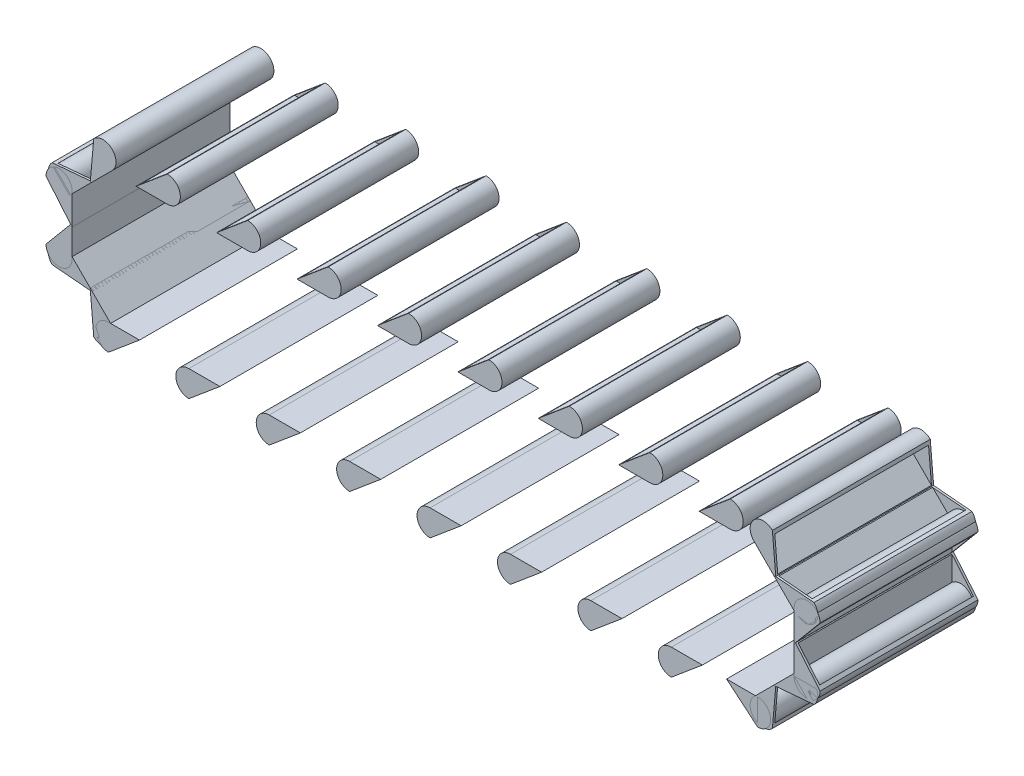
from build123d import *

# Parameters (mm, degrees)
BOSS_EXTRUDE1_DEPTH = 152.4
SHELL2_T            = -2
LPATTERN1_COUNT     = 8
LPATTERN1_PITCH     = 77.614182109
CIRPATTERN1_COUNT   = 5
CIRPATTERN1_ANGLE   = 180
LPATTERN2_COUNT     = 8
LPATTERN2_PITCH     = 77.61418211


with BuildPart() as part:
    # Sketch1 → Boss-Extrude1 (new body)
    with BuildSketch(Plane.XY):
        with BuildLine():
            ThreePointArc((-256.5, 88.672988935), (-243.913505532, 76.086494468), (-256.5, 63.5))
            Line((-256.5, 63.5), (-286.5, 63.5))
            Line((-286.5, 63.5), (-256.5, 88.672988935))
        make_face()
    extrude(amount=BOSS_EXTRUDE1_DEPTH)

    # Shell2
    shell2_openings = [part.faces().sort_by_distance(p)[0] for p in [
        (-271.5, 76.086494468, 76.2),
    ]]
    offset(amount=SHELL2_T, openings=shell2_openings, kind=Kind.INTERSECTION)


with BuildPart() as lpattern1_1:
    # LPattern1: pattern copy
    add(part.part.moved(Location(Vector(1, 0, 0) * (1 * LPATTERN1_PITCH))))


with BuildPart() as lpattern1_2:
    # LPattern1: pattern copy
    add(part.part.moved(Location(Vector(1, 0, 0) * (2 * LPATTERN1_PITCH))))


with BuildPart() as lpattern1_3:
    # LPattern1: pattern copy
    add(part.part.moved(Location(Vector(1, 0, 0) * (3 * LPATTERN1_PITCH))))


with BuildPart() as lpattern1_4:
    # LPattern1: pattern copy
    add(part.part.moved(Location(Vector(1, 0, 0) * (4 * LPATTERN1_PITCH))))


with BuildPart() as lpattern1_5:
    # LPattern1: pattern copy
    add(part.part.moved(Location(Vector(1, 0, 0) * (5 * LPATTERN1_PITCH))))


with BuildPart() as lpattern1_6:
    # LPattern1: pattern copy
    add(part.part.moved(Location(Vector(1, 0, 0) * (6 * LPATTERN1_PITCH))))


with BuildPart() as lpattern1_7:
    # LPattern1: pattern copy
    add(part.part.moved(Location(Vector(1, 0, 0) * (7 * LPATTERN1_PITCH))))


with BuildPart() as cirpattern1_1:
    # CirPattern1: pattern copy
    add(part.part.rotate(Axis((-284.907478003, 0, 0), (0, 0, 1)), 1 * CIRPATTERN1_ANGLE / (CIRPATTERN1_COUNT - 1)))


with BuildPart() as cirpattern1_2:
    # CirPattern1: pattern copy
    add(part.part.rotate(Axis((-284.907478003, 0, 0), (0, 0, 1)), 2 * CIRPATTERN1_ANGLE / (CIRPATTERN1_COUNT - 1)))


with BuildPart() as cirpattern1_3:
    # CirPattern1: pattern copy
    add(part.part.rotate(Axis((-284.907478003, 0, 0), (0, 0, 1)), 3 * CIRPATTERN1_ANGLE / (CIRPATTERN1_COUNT - 1)))


with BuildPart() as cirpattern1_4:
    # CirPattern1: pattern copy
    add(part.part.rotate(Axis((-284.907478003, 0, 0), (0, 0, 1)), 4 * CIRPATTERN1_ANGLE / (CIRPATTERN1_COUNT - 1)))


with BuildPart() as lpattern2_1:
    # LPattern2: pattern copy
    add(cirpattern1_4.part.moved(Location(Vector(1, 0, 0) * (1 * LPATTERN2_PITCH))))


with BuildPart() as lpattern2_2:
    # LPattern2: pattern copy
    add(cirpattern1_4.part.moved(Location(Vector(1, 0, 0) * (2 * LPATTERN2_PITCH))))


with BuildPart() as lpattern2_3:
    # LPattern2: pattern copy
    add(cirpattern1_4.part.moved(Location(Vector(1, 0, 0) * (3 * LPATTERN2_PITCH))))


with BuildPart() as lpattern2_4:
    # LPattern2: pattern copy
    add(cirpattern1_4.part.moved(Location(Vector(1, 0, 0) * (4 * LPATTERN2_PITCH))))


with BuildPart() as lpattern2_5:
    # LPattern2: pattern copy
    add(cirpattern1_4.part.moved(Location(Vector(1, 0, 0) * (5 * LPATTERN2_PITCH))))


with BuildPart() as lpattern2_6:
    # LPattern2: pattern copy
    add(cirpattern1_4.part.moved(Location(Vector(1, 0, 0) * (6 * LPATTERN2_PITCH))))


with BuildPart() as lpattern2_7:
    # LPattern2: pattern copy
    add(cirpattern1_4.part.moved(Location(Vector(1, 0, 0) * (7 * LPATTERN2_PITCH))))


with BuildPart() as body_20:
    # Mirror4: mirrored copy
    add(cirpattern1_1.part.mirror(Plane.ZX))


with BuildPart() as body_21:
    # Mirror4 2: mirrored copy
    add(cirpattern1_2.part.mirror(Plane.ZX))


with BuildPart() as body_22:
    # Mirror4 3: mirrored copy
    add(cirpattern1_3.part.mirror(Plane.ZX))


with BuildPart() as body_23:
    # Mirror5: mirrored copy
    add(cirpattern1_1.part.mirror(Plane(origin=(0, 0, 0), x_dir=(0, 0, 1), z_dir=(1, 0, 0))))


with BuildPart() as body_24:
    # Mirror5 2: mirrored copy
    add(cirpattern1_2.part.mirror(Plane(origin=(0, 0, 0), x_dir=(0, 0, 1), z_dir=(1, 0, 0))))


with BuildPart() as body_25:
    # Mirror5 3: mirrored copy
    add(cirpattern1_3.part.mirror(Plane(origin=(0, 0, 0), x_dir=(0, 0, 1), z_dir=(1, 0, 0))))


with BuildPart() as body_26:
    # Mirror5 4: mirrored copy
    add(cirpattern1_4.part.mirror(Plane(origin=(0, 0, 0), x_dir=(0, 0, 1), z_dir=(1, 0, 0))))


with BuildPart() as body_27:
    # Mirror6: mirrored copy
    add(body_23.part.mirror(Plane.ZX))


with BuildPart() as body_28:
    # Mirror6 2: mirrored copy
    add(body_24.part.mirror(Plane.ZX))


with BuildPart() as body_29:
    # Mirror6 3: mirrored copy
    add(body_25.part.mirror(Plane.ZX))


solid = Compound([part.part, lpattern1_1.part, lpattern1_2.part, lpattern1_3.part, lpattern1_4.part, lpattern1_5.part, lpattern1_6.part, lpattern1_7.part, cirpattern1_1.part, cirpattern1_2.part, cirpattern1_3.part, cirpattern1_4.part, lpattern2_1.part, lpattern2_2.part, lpattern2_3.part, lpattern2_4.part, lpattern2_5.part, lpattern2_6.part, lpattern2_7.part, body_20.part, body_21.part, body_22.part, body_23.part, body_24.part, body_25.part, body_26.part, body_27.part, body_28.part, body_29.part])
